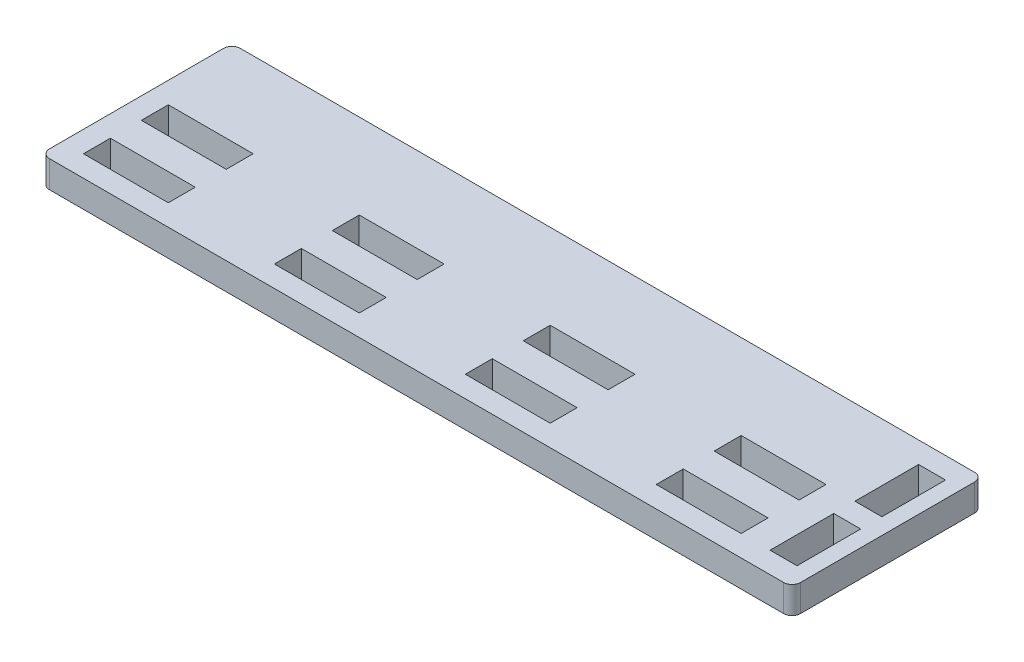
from build123d import *

# Parameters (mm, degrees)
BOSS_EXTRUDE1_DEPTH = 6.35
SKETCH2_W           = 20
SKETCH2_H           = 6.35
CUT_EXTRUDE1_DEPTH  = 172.94569637
SKETCH4_W           = 6.35
SKETCH4_H           = 15
CUT_EXTRUDE2_DEPTH  = 172.94569637
FILLET1_R           = 2


with BuildPart() as part:
    # Sketch1 → Boss-Extrude1 (new body)
    with BuildSketch(Plane(origin=(0, 0, 0), x_dir=(1, 0, 0), z_dir=(0, 1, 0))):
        Polygon((-170, 0), (-170, 20), (0, 20), (7, 20), (7, -25), (0, -25), (-170, -25), align=None)
    extrude(amount=BOSS_EXTRUDE1_DEPTH)

    # Sketch2 → Cut-Extrude1 (cut, through all)
    with BuildSketch(Plane(origin=(0, 6.35, 0), x_dir=(1, 0, 0), z_dir=(0, 1, 0))):
        with Locations((-110, -16.825)):
            Rectangle(SKETCH2_W, SKETCH2_H)
        with Locations((-155, -16.825)):
            Rectangle(SKETCH2_W, SKETCH2_H)
        with Locations((-65, -16.825)):
            Rectangle(SKETCH2_W, SKETCH2_H)
        with Locations((-20, -16.825)):
            Rectangle(SKETCH2_W, SKETCH2_H)
        with Locations((-110, -3.175)):
            Rectangle(SKETCH2_W, SKETCH2_H)
        with Locations((-155, -3.175)):
            Rectangle(SKETCH2_W, SKETCH2_H)
        with Locations((-65, -3.175)):
            Rectangle(SKETCH2_W, SKETCH2_H)
        with Locations((-20, -3.175)):
            Rectangle(SKETCH2_W, SKETCH2_H)
    extrude(amount=-CUT_EXTRUDE1_DEPTH, mode=Mode.SUBTRACT)

    # Sketch4 → Cut-Extrude2 (cut, through all)
    with BuildSketch(Plane(origin=(0, 6.35, 0), x_dir=(1, 0, 0), z_dir=(0, 1, 0))):
        with Locations((0, -12.5)):
            Rectangle(SKETCH4_W, SKETCH4_H)
        with Locations((0, 7.5)):
            Rectangle(SKETCH4_W, SKETCH4_H)
    extrude(amount=-CUT_EXTRUDE2_DEPTH, mode=Mode.SUBTRACT)

    # Fillet1
    fillet1_edges = [part.edges().sort_by_distance(p)[0] for p in [
        (7, 3.175, -20),
        (7, 3.175, 25),
        (-170, 3.175, 25),
        (-170, 3.175, -20),
    ]]
    fillet(fillet1_edges, radius=FILLET1_R)


solid = part.part
